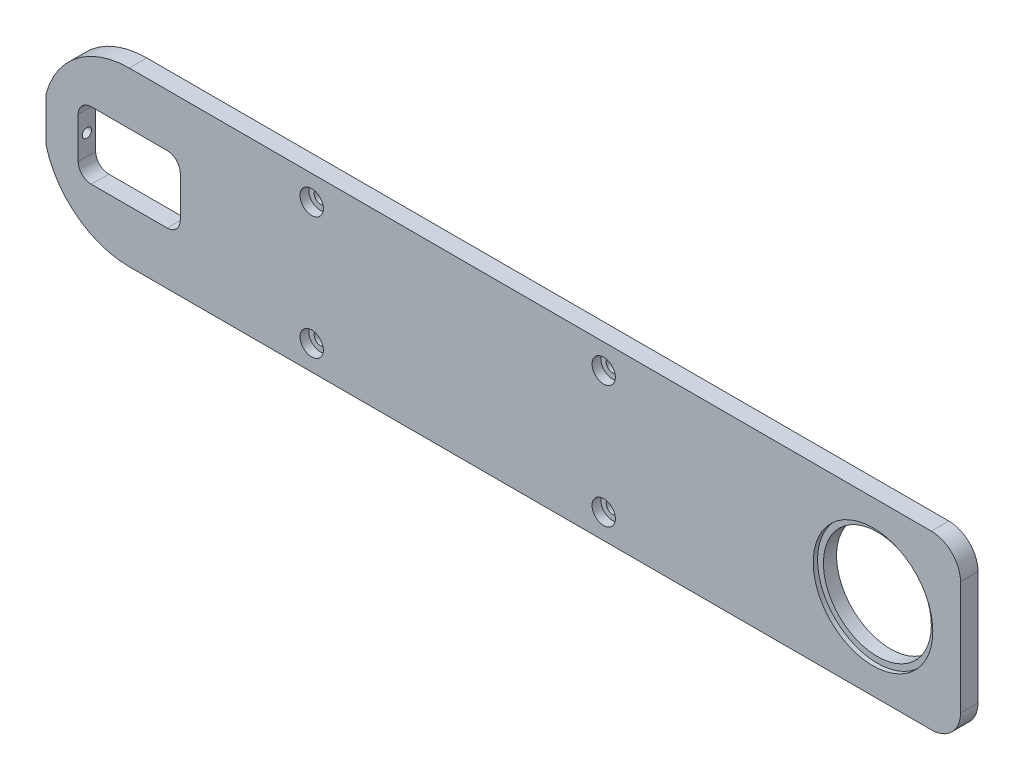
from build123d import *

# Parameters (mm, degrees)
SKETCH_1_R             = 18.5
SKETCH_1_W             = 35
SKETCH_1_H             = 23
EXTRUDE_1_DEPTH        = 3
CUT_EXTRUDE_START      = 1.5
SKETCH_1_3_R           = 20.5
SKETCH_1_3_R_2         = 18.5
CUT_EXTRUDE_1_DEPTH    = 1.5
FILLET_1_R             = 4.5
HOLE_WIZARD_M3_2_D     = 3.2
HOLE_WIZARD_M3_2_DEPTH = 12
HOLE_WIZARD_M4_1_D     = 4.3
SKETCH_1_4_R           = 4
CUT_EXTRUDE_2_DEPTH    = 287.041081094
EXTRUDE_2_DEPTH        = 6
FILLET_2_R             = 10
SKETCH_7_W             = 5
SKETCH_7_H             = 15
CUT_EXTRUDE_3_DEPTH    = 6


with BuildPart() as part:
    # ｽｹｯﾁ1 → ﾎﾞｽ - 押し出し1 (new, symmetric)
    with BuildSketch(Plane.XY):
        with BuildLine():
            Line((0, -29.5), (-255, -29.5))
            ThreePointArc((-255, -29.5), (-284.5, 0), (-255, 29.5))
            Line((-255, 29.5), (0, 29.5))
            ThreePointArc((0, 29.5), (29.5, 0), (0, -29.5))
        make_face()
        Circle(SKETCH_1_R, mode=Mode.SUBTRACT)
        with Locations((-255, 0)):
            Rectangle(SKETCH_1_W, SKETCH_1_H, mode=Mode.SUBTRACT)
    extrude(amount=EXTRUDE_1_DEPTH, both=True)

    # ｽｹｯﾁ1<3> → ｶｯﾄ - 押し出し1 (cut)
    with BuildSketch(Plane.XY.offset(CUT_EXTRUDE_START)):
        Circle(SKETCH_1_3_R)
        Circle(SKETCH_1_3_R_2, mode=Mode.SUBTRACT)
    extrude(amount=CUT_EXTRUDE_1_DEPTH, mode=Mode.SUBTRACT)

    # ﾌｨﾚｯﾄ1
    fillet_1_edges = [part.edges().sort_by_distance(p)[0] for p in [
        (-272.5, 11.5, 0),
        (-272.5, -11.5, 0),
        (-237.5, -11.5, 0),
        (-237.5, 11.5, 0),
    ]]
    fillet(fillet_1_edges, radius=FILLET_1_R)

    # M3 すきま穴2
    with Locations(Plane(origin=(-284.5, 0, 0), x_dir=(0, -1, 0), z_dir=(-1, 0, 0))):
        with Locations((0, 0)):
            Hole(HOLE_WIZARD_M3_2_D / 2, depth=HOLE_WIZARD_M3_2_DEPTH)

    # Hole Wizard M4 _1 (through all)
    with Locations(Plane(origin=(-192.444390405, 21, 3), x_dir=(1, 0, 0), z_dir=(0, 0, 1))):
        with Locations((0, 0), (100.122073915, 0), (100.122073915, -42), (0, -42)):
            Hole(HOLE_WIZARD_M4_1_D / 2)

    # ｽｹｯﾁ1<4> → ｶｯﾄ - 押し出し2 (cut, through all)
    with BuildSketch(Plane.XY):
        with Locations((-192.444390405, -21)):
            Circle(SKETCH_1_4_R)
        with Locations((-192.444390405, 21)):
            Circle(SKETCH_1_4_R)
        with Locations((-92.32231649, 21)):
            Circle(SKETCH_1_4_R)
        with Locations((-92.32231649, -21)):
            Circle(SKETCH_1_4_R)
    extrude(amount=CUT_EXTRUDE_2_DEPTH, mode=Mode.SUBTRACT)

    # ｽｹｯﾁ6 → ﾎﾞｽ - 押し出し2 (add)
    with BuildSketch(Plane.XY.offset(3)):
        with BuildLine():
            Line((0, 29.5), (30, 29.5))
            Line((30, 29.5), (30, -29.5))
            Line((30, -29.5), (0, -29.5))
            ThreePointArc((0, -29.5), (29.5, 0), (0, 29.5))
        make_face()
    extrude(amount=-EXTRUDE_2_DEPTH)

    # ﾌｨﾚｯﾄ2
    fillet_2_edges = [part.edges().sort_by_distance(p)[0] for p in [
        (30, 29.5, 0),
        (30, -29.5, 0),
    ]]
    fillet(fillet_2_edges, radius=FILLET_2_R)

    # ｽｹｯﾁ7 → ｶｯﾄ - 押し出し3 (cut)
    with BuildSketch(Plane.XY.offset(3)):
        with Locations((-286.030685235, 0)):
            Rectangle(SKETCH_7_W, SKETCH_7_H)
    extrude(amount=-CUT_EXTRUDE_3_DEPTH, mode=Mode.SUBTRACT)


solid = part.part
